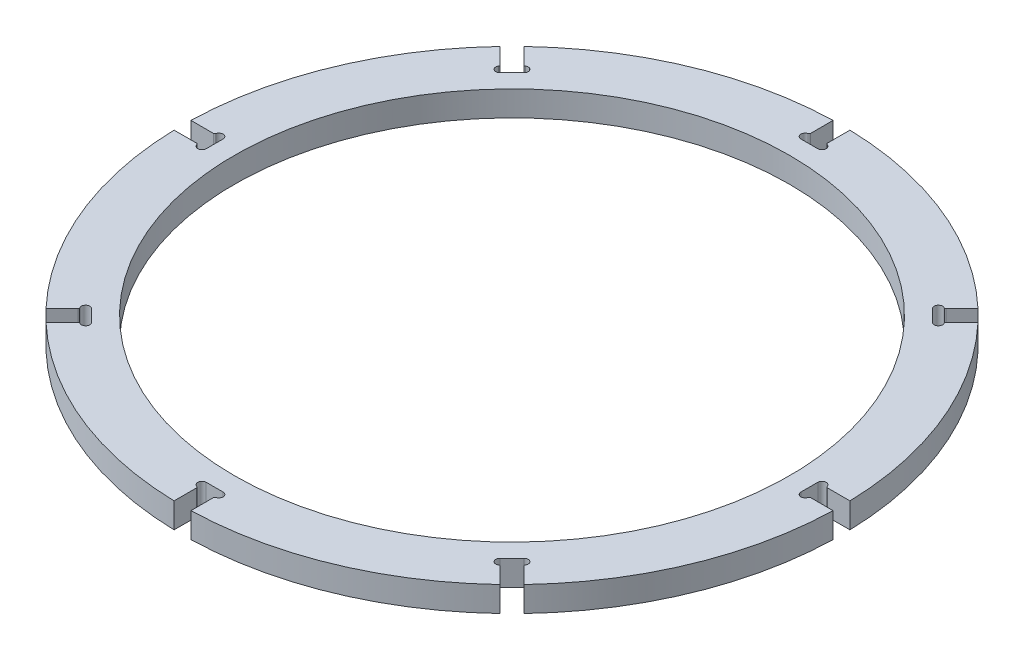
from build123d import *

# Parameters (mm, degrees)
SKETCH1_R                = 250
SKETCH1_R_2              = 210.5
BOSS_EXTRUDE1_DEPTH      = 19.05
CUT_EXTRUDE1_DEPTH       = 355.066240272
FILLET1_R                = 1
CIRPATTERN1_COUNT        = 8
FILLET1_OF_CIRPATTERN1_R = 1


with BuildPart() as part:
    # Sketch1 → Boss-Extrude1 (new body)
    with BuildSketch(Plane(origin=(0, 0, 0), x_dir=(1, 0, 0), z_dir=(0, 1, 0))):
        with Locations(Location((0, 0, 0), (0, 0, 90))):
            Circle(SKETCH1_R)
        with Locations(Location((0, 0, 0), (0, 0, 90))):
            Circle(SKETCH1_R_2, mode=Mode.SUBTRACT)
    extrude(amount=BOSS_EXTRUDE1_DEPTH)

    # Sketch2 → Cut-Extrude1 (cut, through all)
    with BuildSketch(Plane(origin=(0, 19.05, 0), x_dir=(1, 0, 0), z_dir=(0, 1, 0))):
        with BuildLine():
            Line((6.4, 225.5), (-6.4, 225.5))
            ThreePointArc((-6.4, 225.5), (-9.6, 228.7), (-6.4, 231.9))
            Line((-6.4, 231.9), (-6.4, 250))
            Line((-6.4, 250), (6.4, 250))
            Line((6.4, 250), (6.4, 231.9))
            ThreePointArc((6.4, 231.9), (9.6, 228.7), (6.4, 225.5))
        make_face()
    cut_extrude1 = extrude(amount=-CUT_EXTRUDE1_DEPTH, mode=Mode.SUBTRACT)

    # Fillet1
    fillet1_edges = [part.edges().sort_by_distance(p)[0] for p in [
        (-6.4, 9.525, -231.9),
        (6.4, 9.525, -231.9),
    ]]
    fillet(fillet1_edges, radius=FILLET1_R)

    # CirPattern1: Cut-Extrude1 ×8 about axis
    cirpattern1_axis = Axis((0, 0, 0), (0, 1, 0))
    for i in range(1, CIRPATTERN1_COUNT):
        add(cut_extrude1.rotate(cirpattern1_axis, i * 360 / CIRPATTERN1_COUNT), mode=Mode.SUBTRACT)

    # Fillet1 of CirPattern1
    fillet1_of_cirpattern1_edges = [part.edges().sort_by_distance(p)[0] for p in [
        (-168.503545957, 9.525, -159.452579158),
        (-159.452579158, 9.525, -168.503545957),
        (-231.9, 9.525, 6.4),
        (-231.9, 9.525, -6.4),
        (-159.452579158, 9.525, 168.503545957),
        (-168.503545957, 9.525, 159.452579158),
        (6.4, 9.525, 231.9),
        (-6.4, 9.525, 231.9),
        (168.503545957, 9.525, 159.452579158),
        (159.452579158, 9.525, 168.503545957),
        (231.9, 9.525, -6.4),
        (231.9, 9.525, 6.4),
        (159.452579158, 9.525, -168.503545957),
        (168.503545957, 9.525, -159.452579158),
    ]]
    fillet(fillet1_of_cirpattern1_edges, radius=FILLET1_OF_CIRPATTERN1_R)


solid = part.part
